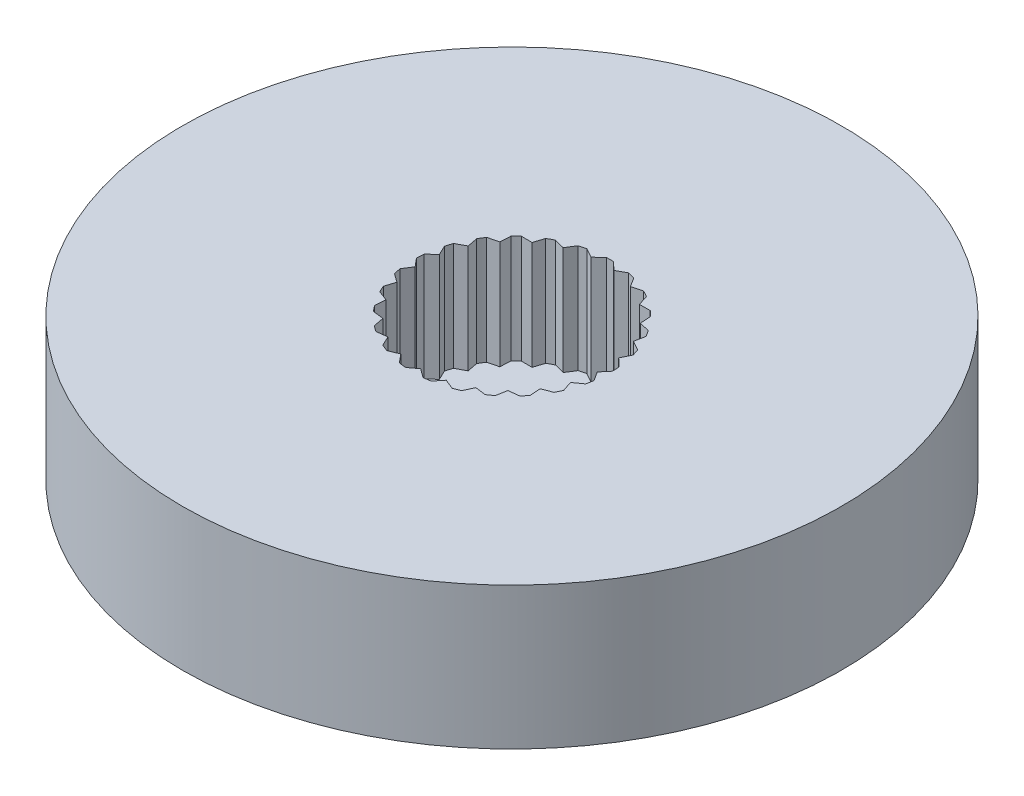
from build123d import *

# Parameters (mm, degrees)
SKETCH2_R           = 9.75
SKETCH2_R_2         = 1.5
BOSS_EXTRUDE1_DEPTH = 0.5
BOSS_EXTRUDE2_START = 3.2
SKETCH3_R           = 9.75
BOSS_EXTRUDE2_DEPTH = 3.2


with BuildPart() as part:
    # Sketch2 → Boss-Extrude1 (new, symmetric)
    with BuildSketch(Plane(origin=(0, 0, 0), x_dir=(1, 0, 0), z_dir=(0, 1, 0))):
        with Locations(Location((0, 0, 0), (0, 0, 270))):
            Circle(SKETCH2_R)
        with Locations(Location((0, 0, 0), (0, 0, 270))):
            Circle(SKETCH2_R_2, mode=Mode.SUBTRACT)
    extrude(amount=BOSS_EXTRUDE1_DEPTH, both=True)

    # Sketch3 → Boss-Extrude2 (add)
    with BuildSketch(Plane(origin=(0, 0.5, 0), x_dir=(1, 0, 0), z_dir=(0, 1, 0)).offset(BOSS_EXTRUDE2_START)):
        with Locations(Location((0, 0, 0), (0, 0, 270))):
            Circle(SKETCH3_R)
        with BuildLine():
            Line((0.107421435, 2.898009771), (0.338399731, 2.678709694))
            Line((0.338399731, 2.678709694), (0.61665913, 2.83367809))
            ThreePointArc((0.61665913, 2.83367809), (0.721200673, 2.808891167), (0.824752316, 2.780248841))
            Line((0.824752316, 2.780248841), (0.993936292, 2.510396512))
            Line((0.993936292, 2.510396512), (1.301992734, 2.591295993))
            ThreePointArc((1.301992734, 2.591295993), (1.397085655, 2.541289372), (1.490260976, 2.48779465))
            Line((1.490260976, 2.48779465), (1.587020181, 2.184345885))
            Line((1.587020181, 2.184345885), (1.905517346, 2.186093238))
            ThreePointArc((1.905517346, 2.186093238), (1.985186607, 2.11400902), (2.062131058, 2.039023173))
            Line((2.062131058, 2.039023173), (2.080385755, 1.721044772))
            Line((2.080385755, 1.721044772), (2.389311295, 1.643530205))
            ThreePointArc((2.389311295, 1.643530205), (2.448550984, 1.553897705), (2.504429862, 1.46213237))
            Line((2.504429862, 1.46213237), (2.443033042, 1.149604087))
            Line((2.443033042, 1.149604087), (2.722976028, 0.997698125))
            ThreePointArc((2.722976028, 0.997698125), (2.758063897, 0.896149284), (2.789366126, 0.793370413))
            Line((2.789366126, 0.793370413), (2.652175577, 0.505929549))
            Line((2.652175577, 0.505929549), (2.885546163, 0.289177003))
            ThreePointArc((2.885546163, 0.289177003), (2.894277512, 0.182092507), (2.899036259, 0.074758075))
            Line((2.899036259, 0.074758075), (2.694672167, -0.169534403))
            Line((2.694672167, -0.169534403), (2.866806821, -0.437514174))
            ThreePointArc((2.866806821, -0.437514174), (2.848633027, -0.543405812), (2.826549281, -0.648551587))
            Line((2.826549281, -0.648551587), (2.567852594, -0.834345885))
            Line((2.567852594, -0.834345885), (2.667935462, -1.136714727))
            ThreePointArc((2.667935462, -1.136714727), (2.623998452, -1.234759946), (2.576459817, -1.331110368))
            Line((2.576459817, -1.331110368), (2.279685399, -1.446732346))
            Line((2.279685399, -1.446732346), (2.301427906, -1.764491312))
            ThreePointArc((2.301427906, -1.764491312), (2.234488404, -1.84852957), (2.164481907, -1.930030589))
            Line((2.164481907, -1.930030589), (1.848277186, -1.968215294))
            Line((1.848277186, -1.968215294), (1.790313171, -2.281398419))
            ThreePointArc((1.790313171, -2.281398419), (1.704577232, -2.346149284), (1.616501638, -2.40767989))
            Line((1.616501638, -2.40767989), (1.30073492, -2.366028036))
            Line((1.30073492, -2.366028036), (1.166706475, -2.654956874))
            ThreePointArc((1.166706475, -2.654956874), (1.067561203, -2.696351809), (0.966950626, -2.734045809))
            Line((0.966950626, -2.734045809), (0.671462695, -2.615174535))
            Line((0.671462695, -2.615174535), (0.469791321, -2.861694623))
            ThreePointArc((0.469791321, -2.861694623), (0.363466377, -2.877132634), (0.25664255, -2.888621575))
            Line((0.25664255, -2.888621575), (0, -2.7))
            Line((0, -2.7), (-0.25664255, -2.888621575))
            ThreePointArc((-0.25664255, -2.888621575), (-0.363466377, -2.877132634), (-0.469791321, -2.861694623))
            Line((-0.469791321, -2.861694623), (-0.671462695, -2.615174535))
            Line((-0.671462695, -2.615174535), (-0.966950626, -2.734045809))
            ThreePointArc((-0.966950626, -2.734045809), (-1.067561203, -2.696351809), (-1.166706475, -2.654956874))
            Line((-1.166706475, -2.654956874), (-1.30073492, -2.366028036))
            Line((-1.30073492, -2.366028036), (-1.616501638, -2.40767989))
            ThreePointArc((-1.616501638, -2.40767989), (-1.704577232, -2.346149284), (-1.790313171, -2.281398419))
            Line((-1.790313171, -2.281398419), (-1.848277186, -1.968215294))
            Line((-1.848277186, -1.968215294), (-2.164481907, -1.930030589))
            ThreePointArc((-2.164481907, -1.930030589), (-2.234488404, -1.84852957), (-2.301427906, -1.764491312))
            Line((-2.301427906, -1.764491312), (-2.279685399, -1.446732346))
            Line((-2.279685399, -1.446732346), (-2.576459817, -1.331110368))
            ThreePointArc((-2.576459817, -1.331110368), (-2.623998452, -1.234759946), (-2.667935462, -1.136714727))
            Line((-2.667935462, -1.136714727), (-2.567852594, -0.834345885))
            Line((-2.567852594, -0.834345885), (-2.826549281, -0.648551587))
            ThreePointArc((-2.826549281, -0.648551587), (-2.848633027, -0.543405812), (-2.866806821, -0.437514174))
            Line((-2.866806821, -0.437514174), (-2.694672167, -0.169534403))
            Line((-2.694672167, -0.169534403), (-2.899036259, 0.074758075))
            ThreePointArc((-2.899036259, 0.074758075), (-2.894277512, 0.182092507), (-2.885546163, 0.289177003))
            Line((-2.885546163, 0.289177003), (-2.652175577, 0.505929549))
            Line((-2.652175577, 0.505929549), (-2.789366126, 0.793370413))
            ThreePointArc((-2.789366126, 0.793370413), (-2.758063897, 0.896149284), (-2.722976028, 0.997698125))
            Line((-2.722976028, 0.997698125), (-2.443033042, 1.149604087))
            Line((-2.443033042, 1.149604087), (-2.504429862, 1.46213237))
            ThreePointArc((-2.504429862, 1.46213237), (-2.448550984, 1.553897705), (-2.389311295, 1.643530205))
            Line((-2.389311295, 1.643530205), (-2.080385755, 1.721044772))
            Line((-2.080385755, 1.721044772), (-2.062131058, 2.039023173))
            ThreePointArc((-2.062131058, 2.039023173), (-1.985186607, 2.11400902), (-1.905517346, 2.186093238))
            Line((-1.905517346, 2.186093238), (-1.587020181, 2.184345885))
            Line((-1.587020181, 2.184345885), (-1.490260976, 2.48779465))
            ThreePointArc((-1.490260976, 2.48779465), (-1.397085655, 2.541289372), (-1.301992734, 2.591295993))
            Line((-1.301992734, 2.591295993), (-0.993936292, 2.510396512))
            Line((-0.993936292, 2.510396512), (-0.824752316, 2.780248841))
            ThreePointArc((-0.824752316, 2.780248841), (-0.721200673, 2.808891167), (-0.61665913, 2.83367809))
            Line((-0.61665913, 2.83367809), (-0.338399731, 2.678709694))
            Line((-0.338399731, 2.678709694), (-0.107421435, 2.898009771))
            ThreePointArc((-0.107421435, 2.898009771), (0, 2.9), (0.107421435, 2.898009771))
        make_face(mode=Mode.SUBTRACT)
    extrude(amount=-BOSS_EXTRUDE2_DEPTH)


solid = part.part
